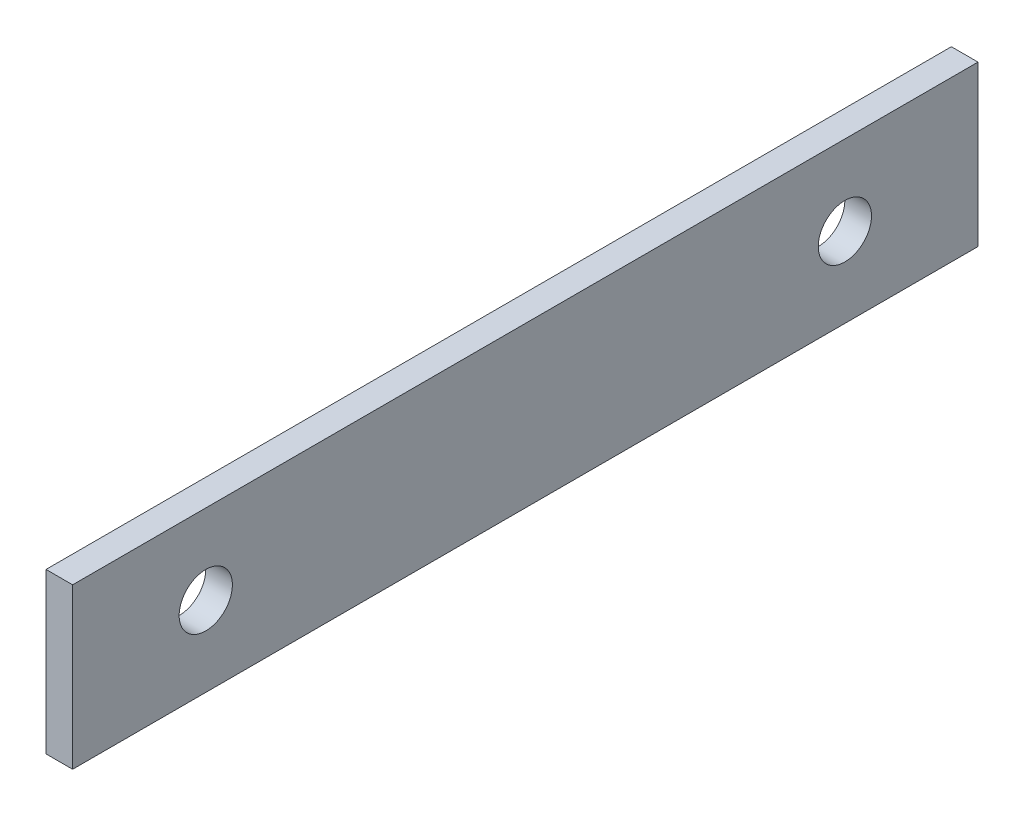
from build123d import *

# Parameters (mm, degrees)
SKETCH1_W           = 170
SKETCH1_H           = 30
SKETCH1_R           = 5
BOSS_EXTRUDE1_DEPTH = 5


with BuildPart() as part:
    # Sketch1 → Boss-Extrude1 (new body)
    with BuildSketch(Plane(origin=(0, 0, 0), x_dir=(0, 0, -1), z_dir=(1, 0, 0))):
        with Locations((85, 15)):
            Rectangle(SKETCH1_W, SKETCH1_H)
        with Locations((25, 15)):
            Circle(SKETCH1_R, mode=Mode.SUBTRACT)
        with Locations((145, 15)):
            Circle(SKETCH1_R, mode=Mode.SUBTRACT)
    extrude(amount=BOSS_EXTRUDE1_DEPTH)


solid = part.part
